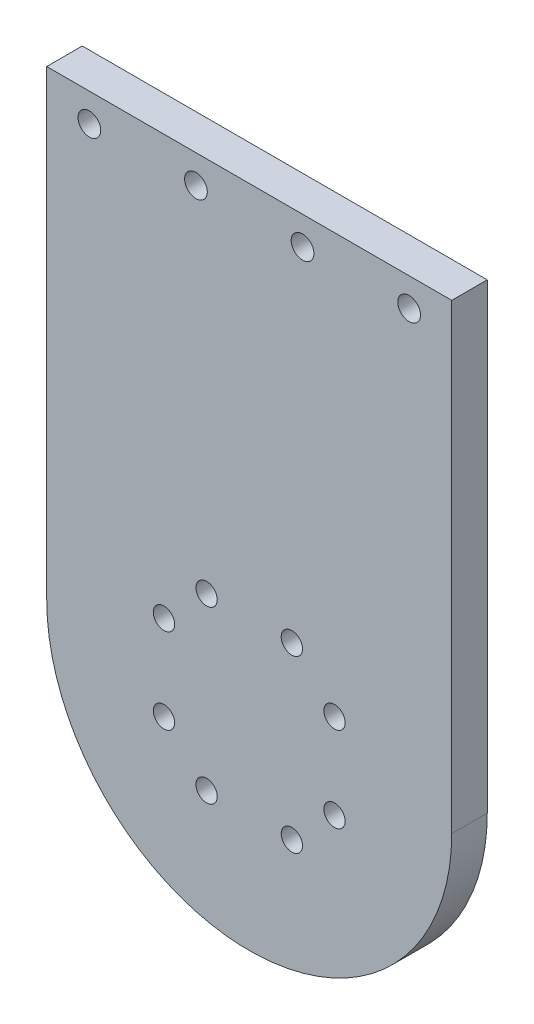
from build123d import *

# Parameters (mm, degrees)
EXTRUDE_1_DEPTH          = 5
CUT_EXTRUDE_2_REACH      = 99.875
SKETCH_3_R               = 1.6
PATTERN_LINEAR_1_COUNT   = 4
PATTERN_LINEAR_1_PITCH   = 15
CUT_EXTRUDE_1_REACH      = 99.875
SKETCH_2_R               = 1.5
PATTERN_CIRCULAR_1_COUNT = 4


with BuildPart() as part:
    # 草圖1 → 填料-伸長1 (new body)
    with BuildSketch(Plane.XY):
        with BuildLine():
            Line((-28.5, 0), (28.5, 0))
            Line((28.5, 0), (28.5, -65))
            ThreePointArc((28.5, -65), (0, -93.5), (-28.5, -65))
            Line((-28.5, -65), (-28.5, 0))
        make_face()
    extrude(amount=EXTRUDE_1_DEPTH)

    # 草圖3 → 除料-伸長2 (cut, up to next)
    with BuildSketch(Plane.XY.offset(5), mode=Mode.PRIVATE) as cut_extrude_2_sk1:
        with Locations((-22.5, -4)):
            Circle(SKETCH_3_R)
    cut_extrude_2_tool1 = extrude(cut_extrude_2_sk1.sketch, amount=-CUT_EXTRUDE_2_REACH, mode=Mode.PRIVATE) & part.part
    cut_extrude_2 = cut_extrude_2_tool1.solids().sort_by_distance((-22.5, -4, 5))[0]
    add(cut_extrude_2, mode=Mode.SUBTRACT)

    # 直線複製排列1: 除料-伸長2 ×4
    with Locations(*[(i * PATTERN_LINEAR_1_PITCH, 0, 0) for i in range(1, PATTERN_LINEAR_1_COUNT)]):
        add(cut_extrude_2, mode=Mode.SUBTRACT)

    # 草圖2 → 除料-伸長1 (cut, up to next)
    with BuildSketch(Plane.XY.offset(5), mode=Mode.PRIVATE) as cut_extrude_1_sk1:
        with Locations((-6, -53)):
            Circle(SKETCH_2_R)
    cut_extrude_1_tool1 = extrude(cut_extrude_1_sk1.sketch, amount=-CUT_EXTRUDE_1_REACH, mode=Mode.PRIVATE) & part.part
    # 草圖2 → 除料-伸長1 (cut, up to next)
    with BuildSketch(Plane.XY.offset(5), mode=Mode.PRIVATE) as cut_extrude_1_sk2:
        with Locations((-12, -59)):
            Circle(SKETCH_2_R)
    cut_extrude_1_tool2 = extrude(cut_extrude_1_sk2.sketch, amount=-CUT_EXTRUDE_1_REACH, mode=Mode.PRIVATE) & part.part
    cut_extrude_1_1 = cut_extrude_1_tool1.solids().sort_by_distance((-6, -53, 5))[0]
    add(cut_extrude_1_1, mode=Mode.SUBTRACT)
    cut_extrude_1_2 = cut_extrude_1_tool2.solids().sort_by_distance((-12, -59, 5))[0]
    add(cut_extrude_1_2, mode=Mode.SUBTRACT)
    cut_extrude_1 = cut_extrude_1_1 + cut_extrude_1_2  # 除料-伸長1 as one shape, for the pattern or mirror that repeats it

    # 環狀複製排列1: 除料-伸長1 ×4 about axis
    pattern_circular_1_axis = Axis((0, -65, 0), (0, 0, 1))
    for i in range(1, PATTERN_CIRCULAR_1_COUNT):
        add(cut_extrude_1.rotate(pattern_circular_1_axis, i * 360 / PATTERN_CIRCULAR_1_COUNT), mode=Mode.SUBTRACT)


solid = part.part
